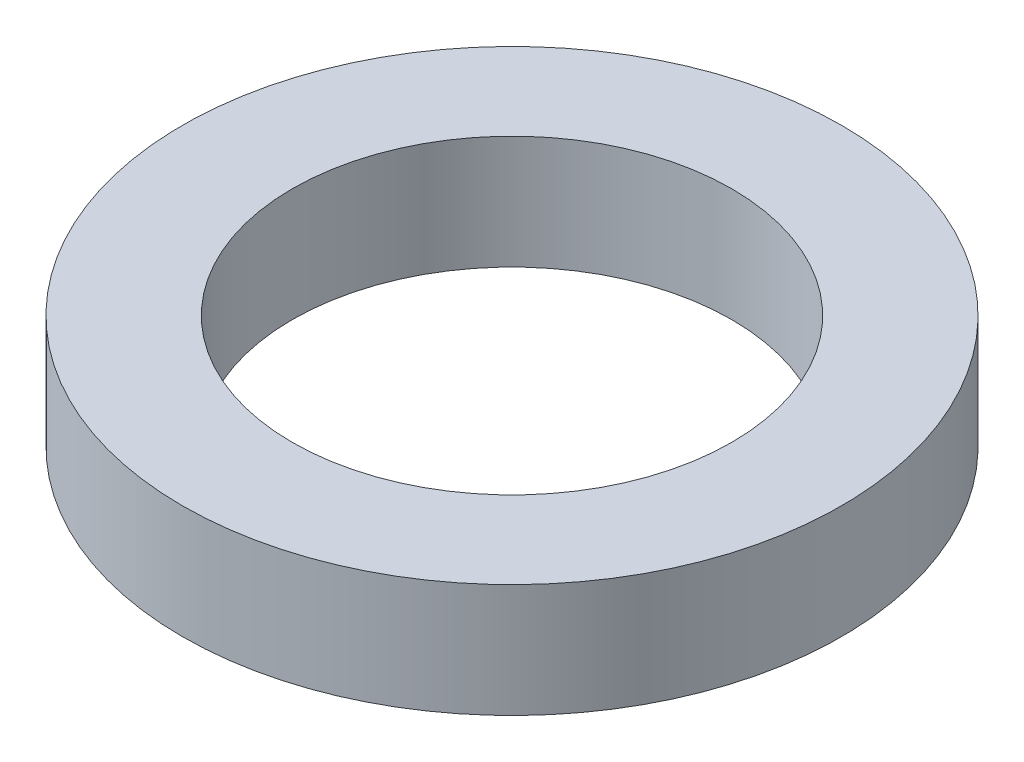
from build123d import *

# Parameters (mm, degrees)
SKETCH1_R           = 4.7625
SKETCH1_R_2         = 3.175
EXTRUDE_THIN1_DEPTH = 1.6383


with BuildPart() as part:
    # Sketch1 → Extrude-Thin1 (new body)
    with BuildSketch(Plane(origin=(0, 0, 0), x_dir=(1, 0, 0), z_dir=(0, 1, 0))):
        Circle(SKETCH1_R)
        Circle(SKETCH1_R_2, mode=Mode.SUBTRACT)
    extrude(amount=EXTRUDE_THIN1_DEPTH)


solid = part.part
